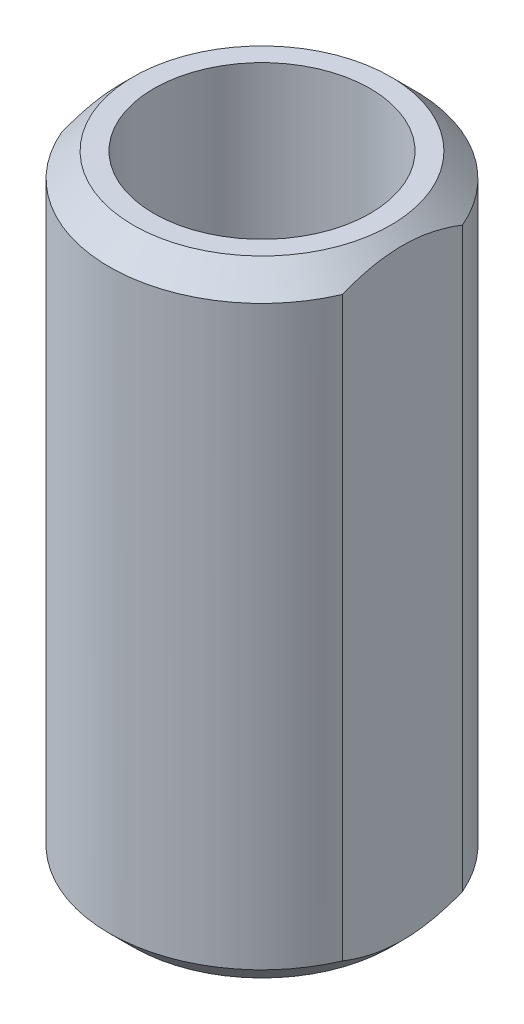
from build123d import *

# Parameters (mm, degrees)
CUT_EXTRUDE1_DEPTH      = 16.800158227
CUT_EXTRUDE1_DEPTH_BACK = 16.800158227
SKETCH2_W               = 6.200894729
SKETCH2_H               = 5
SKETCH2_W_2             = 7.80745867


with BuildPart() as part:
    # Sketch1 → Revolve1 (revolve)
    with BuildSketch(Plane.XY, mode=Mode.PRIVATE) as revolve1_sk:
        Polygon((-4.5, 13), (-5.35, 13), (-6.35, 12), (-6.35, -12), (-5.35, -13), (-4.5, -13), align=None)
    revolve(revolve1_sk.sketch.rotate(Axis((0, 18.016627358, 0), (0, -1, 0)), 270), axis=Axis((0, 18.016627358, 0), (0, -1, 0)))

    # Sketch2 → Cut-Extrude1 (cut, two sides: drawn at the far end of the back side and taken through both)
    with BuildSketch(Plane(origin=(0, 0, 0), x_dir=(1, 0, 0), z_dir=(0, 1, 0)).offset(-CUT_EXTRUDE1_DEPTH_BACK)):
        with Locations((-8.937612772, 0)):
            Rectangle(SKETCH2_W, SKETCH2_H)
        with Locations((9.740894743, 0)):
            Rectangle(SKETCH2_W_2, SKETCH2_H)
    extrude(amount=CUT_EXTRUDE1_DEPTH + CUT_EXTRUDE1_DEPTH_BACK, mode=Mode.SUBTRACT)


solid = part.part
